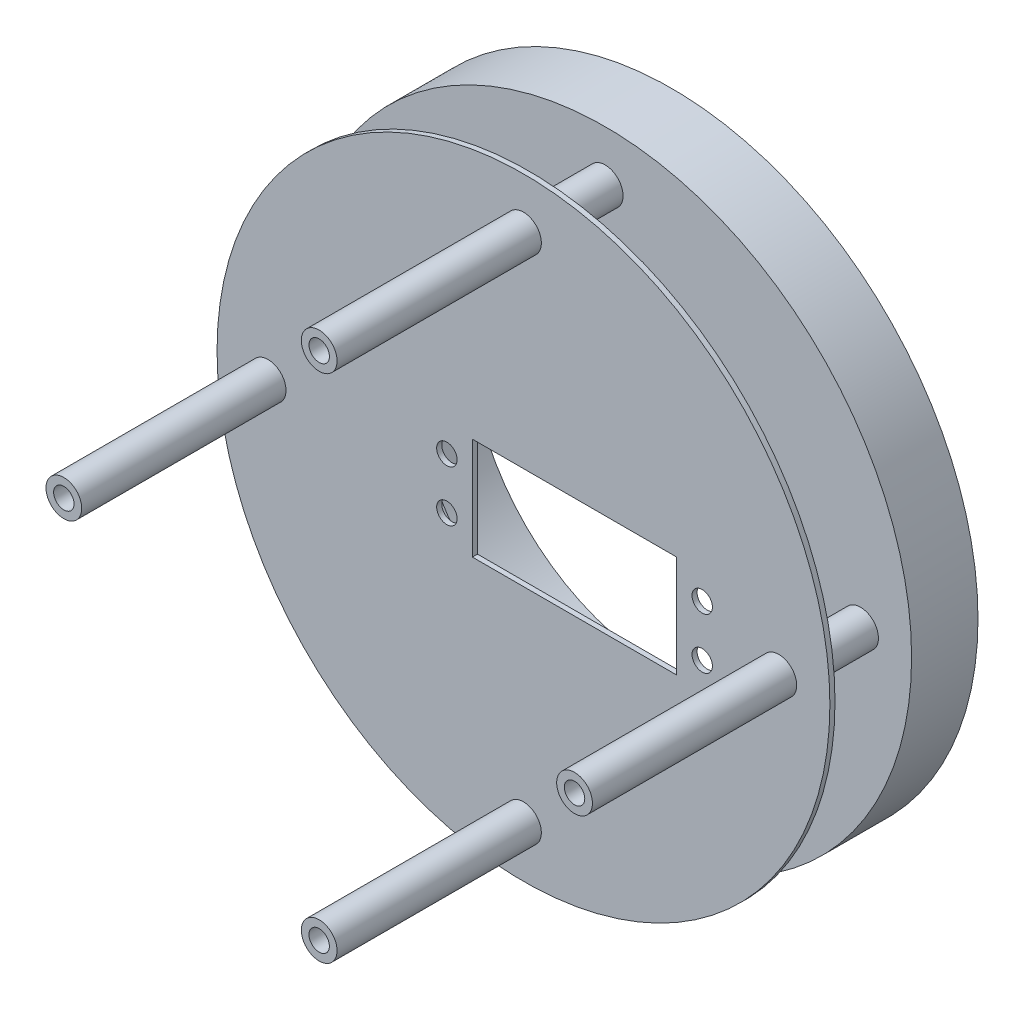
from build123d import *

# Parameters (mm, degrees)
SKETCH_1_R          = 60
SKETCH_1_R_2        = 37.5
EXTRUDE_1_DEPTH     = 13
SKETCH_4_R          = 60
SKETCH_4_R_2        = 2
SKETCH_4_W          = 40
SKETCH_4_H          = 20
EXTRUDE_2_DEPTH     = 1
SKETCH_5_R          = 3.5
EXTRUDE_3_DEPTH     = 56
SKETCH_6_R          = 2
CUT_EXTRUDE_1_DEPTH = 5
SKETCH_7_R          = 45
CUT_EXTRUDE_2_DEPTH = 2


with BuildPart() as part:
    # 草图1 → 凸台-拉伸1 (new body)
    with BuildSketch(Plane.XY):
        with Locations(Location((0, 0, 0), (0, 0, 180))):
            Circle(SKETCH_1_R)
        with Locations(Location((0, 0, 0), (0, 0, 180))):
            Circle(SKETCH_1_R_2, mode=Mode.SUBTRACT)
    extrude(amount=EXTRUDE_1_DEPTH)



with BuildPart() as body_2:
    # 草图4 → 凸台-拉伸2 (new body)
    with BuildSketch(Plane.XY.offset(28)):
        with Locations(Location((0, 0, 0), (0, 0, 180))):
            Circle(SKETCH_4_R)
        with Locations((-15, 5)):
            Circle(SKETCH_4_R_2, mode=Mode.SUBTRACT)
        with Locations((35, 5)):
            Circle(SKETCH_4_R_2, mode=Mode.SUBTRACT)
        with Locations((35, -5)):
            Circle(SKETCH_4_R_2, mode=Mode.SUBTRACT)
        with Locations((-15, -5)):
            Circle(SKETCH_4_R_2, mode=Mode.SUBTRACT)
        with Locations((10, 0)):
            Rectangle(SKETCH_4_W, SKETCH_4_H, mode=Mode.SUBTRACT)
    extrude(amount=EXTRUDE_2_DEPTH)


with BuildPart() as part_1:
    add(part.part)

    add(body_2.part)  # 凸台-拉伸3 merges body 2
    # 草图5 → 凸台-拉伸3 (add)
    with BuildSketch(Plane.XY.offset(13)):
        with Locations((50, 0)):
            Circle(SKETCH_5_R)
        with Locations((0, -50)):
            Circle(SKETCH_5_R)
        with Locations((-50, 0)):
            Circle(SKETCH_5_R)
        with Locations((0, 50)):
            Circle(SKETCH_5_R)
    extrude(amount=EXTRUDE_3_DEPTH)

    # 草图6 → 切除-拉伸1 (cut)
    with BuildSketch(Plane.XY.offset(69)):
        with Locations((50, 0)):
            Circle(SKETCH_6_R)
        with Locations((0, 50)):
            Circle(SKETCH_6_R)
        with Locations((-50, 0)):
            Circle(SKETCH_6_R)
        with Locations((0, -50)):
            Circle(SKETCH_6_R)
    extrude(amount=-CUT_EXTRUDE_1_DEPTH, mode=Mode.SUBTRACT)

    # 草图7 → 切除-拉伸2 (cut)
    with BuildSketch(Plane(origin=(0, 0, 0), x_dir=(-1, 0, 0), z_dir=(0, 0, -1))):
        Circle(SKETCH_7_R)
    extrude(amount=-CUT_EXTRUDE_2_DEPTH, mode=Mode.SUBTRACT)


solid = part_1.part
